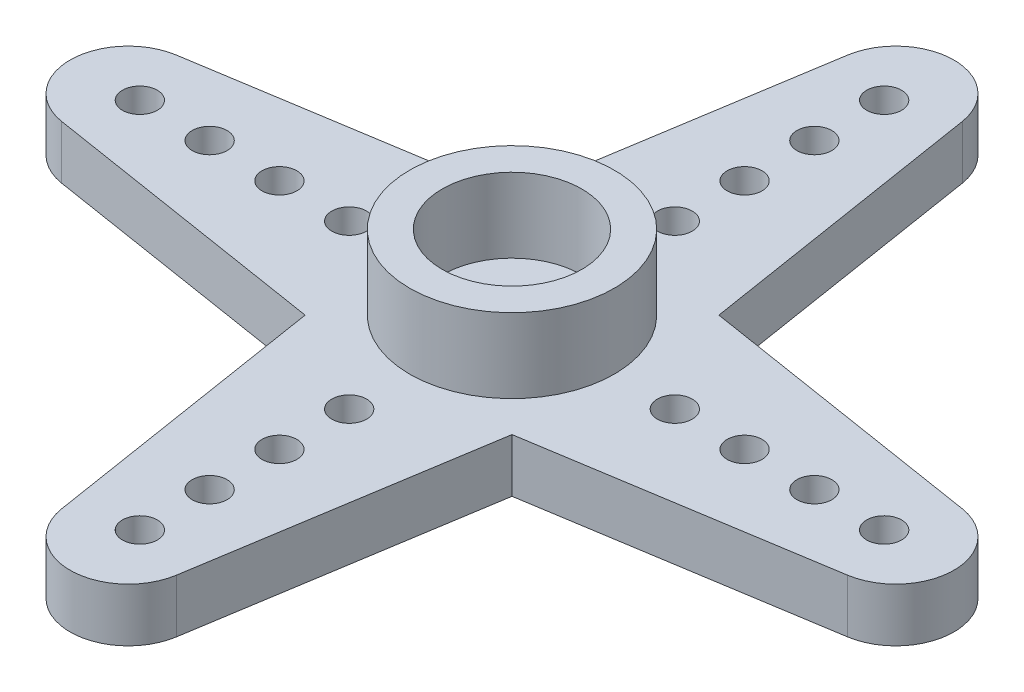
from build123d import *

# Parameters (mm, degrees)
SKETCH1_R           = 6.1
SKETCH1_R_2         = 1.5
BOSS_EXTRUDE1_DEPTH = 2.3
SKETCH2_R           = 4.4
SKETCH2_R_2         = 3
BOSS_EXTRUDE2_DEPTH = 3.2
BOSS_EXTRUDE3_DEPTH = 2.3
CIRPATTERN1_COUNT   = 4


with BuildPart() as part:
    # Sketch1 → Boss-Extrude1 (new body)
    with BuildSketch(Plane(origin=(0, 0, 0), x_dir=(1, 0, 0), z_dir=(0, 1, 0))):
        with Locations(Location((0, 0, 0), (0, 0, 270))):
            Circle(SKETCH1_R)
        with Locations(Location((0, 0, 0), (0, 0, 270))):
            Circle(SKETCH1_R_2, mode=Mode.SUBTRACT)
    extrude(amount=BOSS_EXTRUDE1_DEPTH)

    # Sketch2 → Boss-Extrude2 (add)
    with BuildSketch(Plane(origin=(0, 2.3, 0), x_dir=(1, 0, 0), z_dir=(0, 1, 0))):
        with Locations(Location((0, 0, 0), (0, 0, 270))):
            Circle(SKETCH2_R)
        with Locations(Location((0, 0, 0), (0, 0, 270))):
            Circle(SKETCH2_R_2, mode=Mode.SUBTRACT)
    extrude(amount=BOSS_EXTRUDE2_DEPTH)

    # Sketch3 → Boss-Extrude3 (add)
    with BuildSketch(Plane.XZ):
        with BuildLine():
            ThreePointArc((4.5, -4.118252056), (2.458522163, -5.582622034), (0, -6.1))
            Line((0, -6.1), (0, -6.25))
            ThreePointArc((0, -6.25), (0.530330086, -6.469669914), (0.75, -7))
            ThreePointArc((0.75, -7), (0.530330086, -7.530330086), (0, -7.75))
            Line((0, -7.75), (0, -9.25))
            ThreePointArc((0, -9.25), (0.530330086, -9.469669914), (0.75, -10))
            ThreePointArc((0.75, -10), (0.530330086, -10.530330086), (0, -10.75))
            Line((0, -10.75), (0, -12.25))
            ThreePointArc((0, -12.25), (0.530330086, -12.469669914), (0.75, -13))
            ThreePointArc((0.75, -13), (0.530330086, -13.530330086), (0, -13.75))
            Line((0, -13.75), (0, -15.25))
            ThreePointArc((0, -15.25), (0.530330086, -15.469669914), (0.75, -16))
            ThreePointArc((0.75, -16), (0.530330086, -16.530330086), (0, -16.75))
            Line((0, -16.75), (0, -19))
            ThreePointArc((0, -19), (1.623056726, -18.401495955), (2.468988638, -16.892549493))
            Line((2.468988638, -16.892549493), (4.5, -4.118252056))
        make_face()
        with BuildLine():
            Line((0, -6.25), (0, -6.1))
            ThreePointArc((0, -6.1), (-2.458522163, -5.582622034), (-4.5, -4.118252056))
            Line((-4.5, -4.118252056), (-2.468988638, -16.892549493))
            ThreePointArc((-2.468988638, -16.892549493), (-1.623056726, -18.401495955), (0, -19))
            Line((0, -19), (0, -16.75))
            ThreePointArc((0, -16.75), (-0.75, -16), (0, -15.25))
            Line((0, -15.25), (0, -13.75))
            ThreePointArc((0, -13.75), (-0.75, -13), (0, -12.25))
            Line((0, -12.25), (0, -10.75))
            ThreePointArc((0, -10.75), (-0.75, -10), (0, -9.25))
            Line((0, -9.25), (0, -7.75))
            ThreePointArc((0, -7.75), (-0.75, -7), (0, -6.25))
        make_face()
    boss_extrude3 = extrude(amount=-BOSS_EXTRUDE3_DEPTH)

    # CirPattern1: Boss-Extrude3 ×4 about axis
    cirpattern1_axis = Axis((0, 0, 0), (0, 1, 0))
    for i in range(1, CIRPATTERN1_COUNT):
        add(boss_extrude3.rotate(cirpattern1_axis, i * 360 / CIRPATTERN1_COUNT))


solid = part.part
